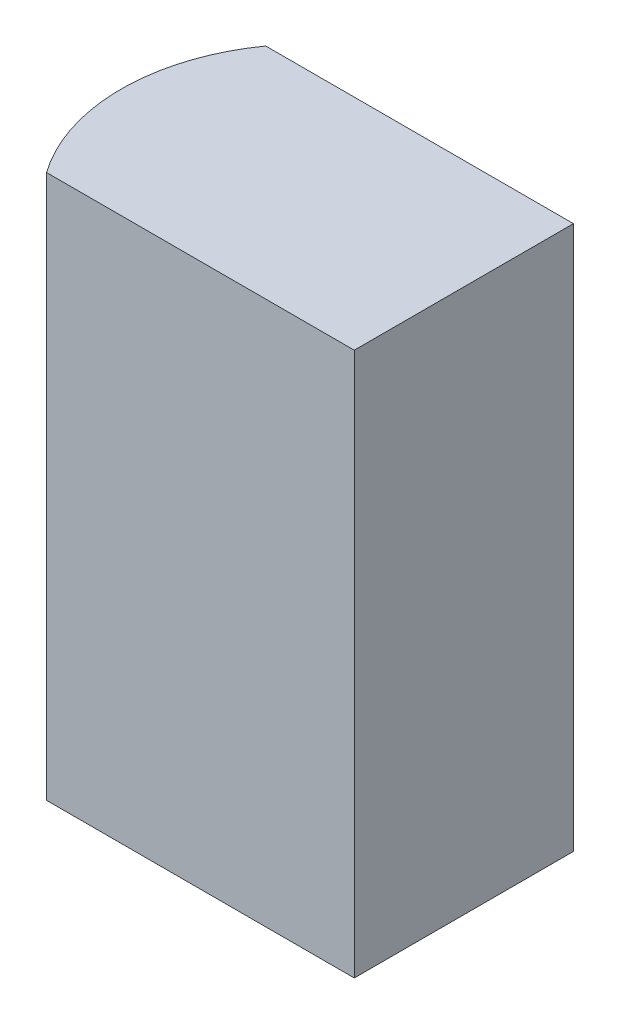
from build123d import *

# Parameters (mm, degrees)
BOSS_EXTRUDE1_DEPTH = 645


with BuildPart() as part:
    # Sketch1 → Boss-Extrude1 (new body)
    with BuildSketch(Plane(origin=(0, 0, 0), x_dir=(1, 0, 0), z_dir=(0, 1, 0))):
        with BuildLine():
            Line((-182.5, -130), (182.5, -130))
            Line((182.5, -130), (182.5, 130))
            Line((182.5, 130), (-182.5, 130))
            ThreePointArc((-182.5, 130), (-224.067512148, 0), (-182.5, -130))
        make_face()
    extrude(amount=BOSS_EXTRUDE1_DEPTH)


solid = part.part
